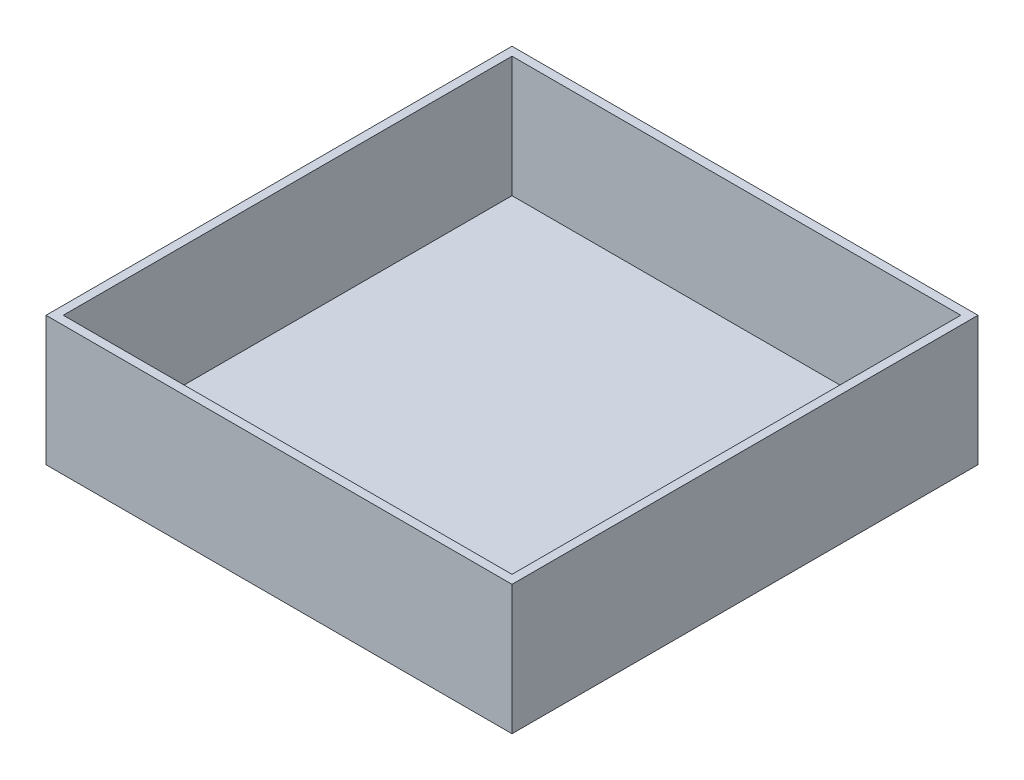
from build123d import *

# Parameters (mm, degrees)
SKETCH1_W      = 8229.6
SKETCH1_H      = 8229.6
EXTRUDE2_DEPTH = 2133.6
SKETCH3_W      = 7924.8
SKETCH3_H      = 7924.8
EXTRUDE3_DEPTH = 11833.365836129
SKETCH4_W      = 8229.6
SKETCH4_H      = 8229.6
SKETCH4_W_2    = 7924.8
SKETCH4_H_2    = 7924.8
EXTRUDE4_DEPTH = 152.4
SKETCH6_W      = 7924.8
SKETCH6_H      = 152.4
EXTRUDE5_DEPTH = 7924.8


with BuildPart() as part:
    # Sketch1 → Extrude2 (new body)
    with BuildSketch(Plane(origin=(0, 0, 0), x_dir=(1, 0, 0), z_dir=(0, 1, 0))):
        with Locations((4114.8, 4114.8)):
            Rectangle(SKETCH1_W, SKETCH1_H)
    extrude(amount=EXTRUDE2_DEPTH)

    # Sketch3 → Extrude3 (cut, through all)
    with BuildSketch(Plane(origin=(0, 2133.6, 0), x_dir=(1, 0, 0), z_dir=(0, 1, 0))):
        with Locations((4114.8, 4114.8)):
            Rectangle(SKETCH3_W, SKETCH3_H)
    extrude(amount=-EXTRUDE3_DEPTH, mode=Mode.SUBTRACT)

    # Sketch4 → Extrude4 (add)
    with BuildSketch(Plane.XZ):
        with Locations((4114.8, -4114.8)):
            Rectangle(SKETCH4_W, SKETCH4_H)
        with Locations((4114.8, -4114.8)):
            Rectangle(SKETCH4_W_2, SKETCH4_H_2, mode=Mode.SUBTRACT)
    extrude(amount=EXTRUDE4_DEPTH)

    # Sketch6 → Extrude5 (add)
    with BuildSketch(Plane(origin=(0, 0, -152.4), x_dir=(-1, 0, 0), z_dir=(0, 0, -1))):
        with Locations((-4114.8, -76.2)):
            Rectangle(SKETCH6_W, SKETCH6_H)
    extrude(amount=EXTRUDE5_DEPTH)


solid = part.part
